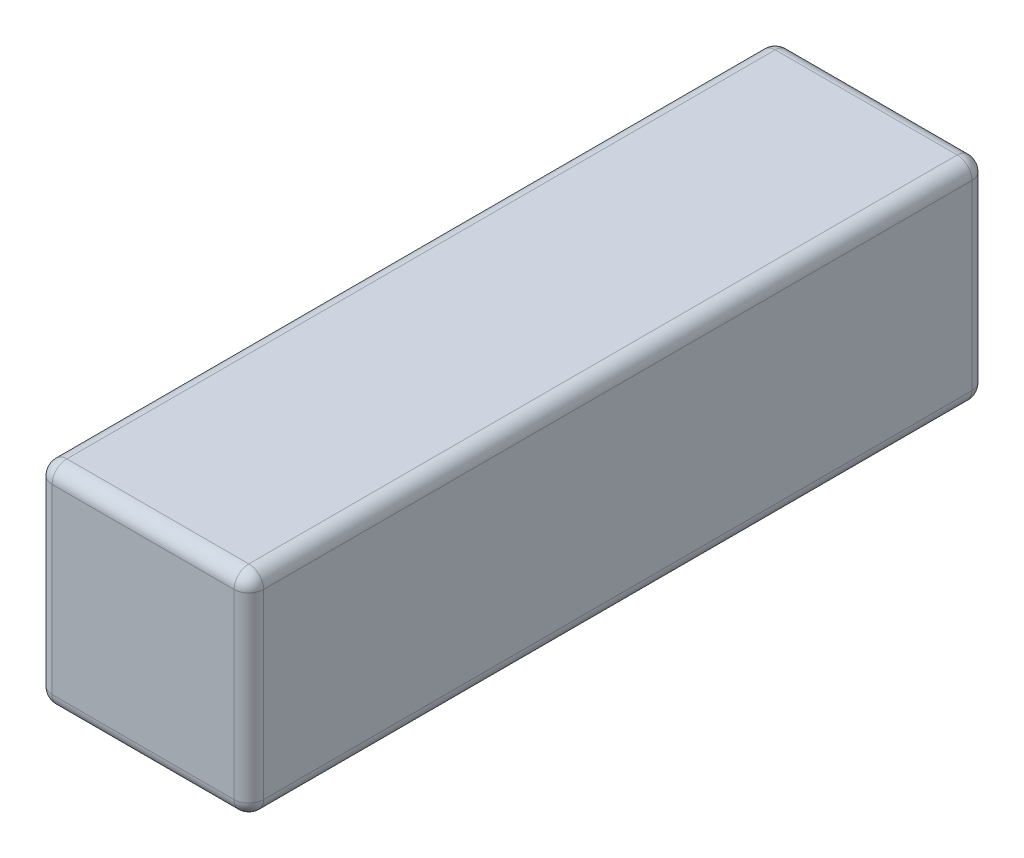
from build123d import *

# Parameters (mm, degrees)
EXTRUDE_1_DEPTH = 21.5
FILLET_1_R      = 3


with BuildPart() as part:
    # 草图1 → 凸台-拉伸1 (new, symmetric)
    with BuildSketch(Plane(origin=(0, 0, 0), x_dir=(1, 0, 0), z_dir=(0, 1, 0))):
        with BuildLine():
            Line((-18.5, -75), (18.5, -75))
            ThreePointArc((18.5, -75), (20.621320344, -74.121320344), (21.5, -72))
            Line((21.5, -72), (21.5, 72))
            ThreePointArc((21.5, 72), (20.621320344, 74.121320344), (18.5, 75))
            Line((18.5, 75), (-18.5, 75))
            ThreePointArc((-18.5, 75), (-20.621320344, 74.121320344), (-21.5, 72))
            Line((-21.5, 72), (-21.5, -72))
            ThreePointArc((-21.5, -72), (-20.621320344, -74.121320344), (-18.5, -75))
        make_face()
    extrude(amount=EXTRUDE_1_DEPTH, both=True)

    # 圆角1
    fillet_1_edges = [part.edges().sort_by_distance(p)[0] for p in [
        (21.5, -21.5, 0),
        (20.621320344, -21.5, 74.121320344),
        (0, -21.5, 75),
        (-20.621320344, -21.5, 74.121320344),
        (20.621320344, 21.5, 74.121320344),
        (21.5, 21.5, 0),
        (20.621320344, 21.5, -74.121320344),
        (0, 21.5, -75),
        (-20.621320344, 21.5, -74.121320344),
        (-21.5, 21.5, 0),
        (-20.621320344, 21.5, 74.121320344),
        (-21.5, -21.5, 0),
        (0, 21.5, 75),
        (-20.621320344, -21.5, -74.121320344),
        (0, -21.5, -75),
        (20.621320344, -21.5, -74.121320344),
    ]]
    fillet(fillet_1_edges, radius=FILLET_1_R)


solid = part.part
